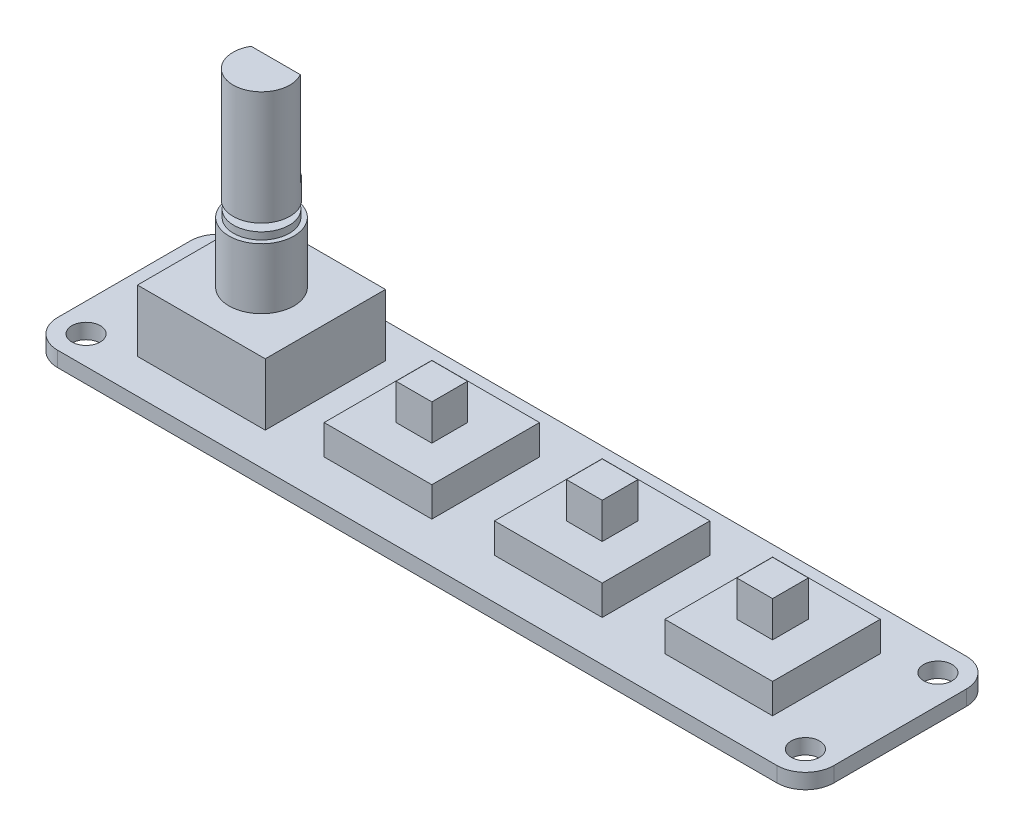
from build123d import *

# Parameters (mm, degrees)
SKETCH1_W           = 82
SKETCH1_H           = 20
BOSS_EXTRUDE1_DEPTH = 1.6
SKETCH2_W           = 11.38
SKETCH2_H           = 11.38
BOSS_EXTRUDE2_DEPTH = 3.15
SKETCH2_3_W         = 13.5
SKETCH2_3_H         = 12.7
BOSS_EXTRUDE3_DEPTH = 6.53
SKETCH3_W           = 3.78
SKETCH3_H           = 3.78
BOSS_EXTRUDE4_DEPTH = 3.78
SKETCH5_W           = 5.190366076
SKETCH5_H           = 1.495
CUT_EXTRUDE1_DEPTH  = 10
SKETCH6_R           = 1.5
CUT_EXTRUDE2_DEPTH  = 50.848178502
FILLET1_R           = 3


with BuildPart() as part:
    # Sketch1 → Boss-Extrude1 (new body)
    with BuildSketch(Plane(origin=(0, 0, 0), x_dir=(1, 0, 0), z_dir=(0, 1, 0))):
        Rectangle(SKETCH1_W, SKETCH1_H)
    extrude(amount=BOSS_EXTRUDE1_DEPTH)

    # Sketch2 → Boss-Extrude2 (add)
    with BuildSketch(Plane(origin=(0, 1.6, 0), x_dir=(1, 0, 0), z_dir=(0, 1, 0))):
        with Locations((27.53, 0)):
            Rectangle(SKETCH2_W, SKETCH2_H)
        with Locations((9.53, 0)):
            Rectangle(SKETCH2_W, SKETCH2_H)
        with Locations((-8.47, 0)):
            Rectangle(SKETCH2_W, SKETCH2_H)
    extrude(amount=BOSS_EXTRUDE2_DEPTH)

    # Sketch2<3> → Boss-Extrude3 (add)
    with BuildSketch(Plane(origin=(0, 1.6, 0), x_dir=(1, 0, 0), z_dir=(0, 1, 0))):
        with Locations((-26.47, 0)):
            Rectangle(SKETCH2_3_W, SKETCH2_3_H)
    extrude(amount=BOSS_EXTRUDE3_DEPTH)

    # Sketch3 → Boss-Extrude4 (add)
    with BuildSketch(Plane(origin=(0, 4.75, 0), x_dir=(1, 0, 0), z_dir=(0, 1, 0))):
        with Locations((-8.47, 0)):
            Rectangle(SKETCH3_W, SKETCH3_H)
        with Locations((9.53, 0)):
            Rectangle(SKETCH3_W, SKETCH3_H)
        with Locations((27.53, 0)):
            Rectangle(SKETCH3_W, SKETCH3_H)
    extrude(amount=BOSS_EXTRUDE4_DEPTH)

    # Sketch4 → Revolve1 (revolve)
    with BuildSketch(Plane.XY):
        Polygon((-23.04, 8.13), (-23.04, 14.53), (-23.525, 14.53), (-23.525, 15.28), (-24.885, 15.28), (-24.885, 16.11), (-23.47, 16.11), (-23.47, 28.13), (-26.47, 28.13), (-26.47, 8.13), align=None)
    revolve(axis=Axis((-26.47, 8.13, 0), (0, 1, 0)))

    # Sketch5 → Cut-Extrude1 (cut)
    with BuildSketch(Plane(origin=(0, 28.13, 0), x_dir=(1, 0, 0), z_dir=(0, 1, 0))):
        with Locations((-26.47, 2.2525)):
            Rectangle(SKETCH5_W, SKETCH5_H)
    extrude(amount=-CUT_EXTRUDE1_DEPTH, mode=Mode.SUBTRACT)

    # Sketch6 → Cut-Extrude2 (cut, through all)
    with BuildSketch(Plane(origin=(0, 1.6, 0), x_dir=(1, 0, 0), z_dir=(0, 1, 0))):
        with Locations((-38, 7)):
            Circle(SKETCH6_R)
        with Locations((-38, -7)):
            Circle(SKETCH6_R)
        with Locations((38, -7)):
            Circle(SKETCH6_R)
        with Locations((38, 7)):
            Circle(SKETCH6_R)
    extrude(amount=-CUT_EXTRUDE2_DEPTH, mode=Mode.SUBTRACT)

    # Fillet1
    fillet1_edges = [part.edges().sort_by_distance(p)[0] for p in [
        (41, 0.8, 10),
        (41, 0.8, -10),
        (-41, 0.8, 10),
        (-41, 0.8, -10),
    ]]
    fillet(fillet1_edges, radius=FILLET1_R)


solid = part.part
